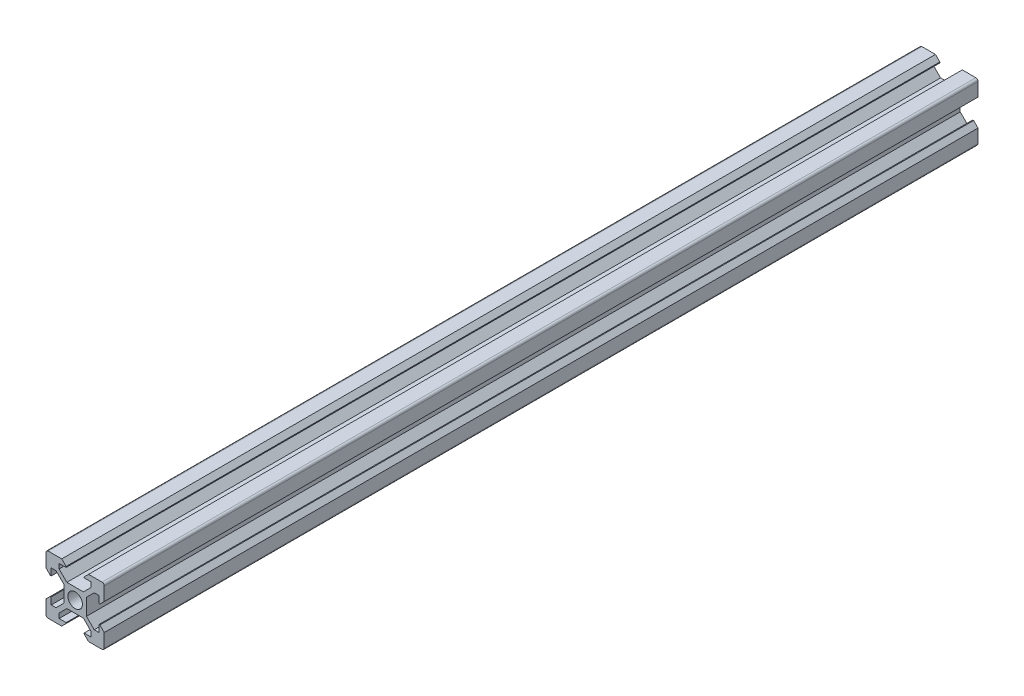
from build123d import *

# Parameters (mm, degrees)
CROQUIS1_R              = 2.5
SALIENTE_EXTRUIR1_DEPTH = 300


with BuildPart() as part:
    # Croquis1 → Saliente-Extruir1 (new body)
    with BuildSketch(Plane.XY):
        with BuildLine():
            Line((-4.6, 10), (-3.1, 8.5))
            Line((-3.1, 8.5), (-3.1, 8.2))
            Line((-3.1, 8.2), (-5.5, 8.2))
            Line((-5.5, 8.2), (-5.5, 6.560660172))
            Line((-5.5, 6.560660172), (-2.84, 3.900660172))
            Line((-2.84, 3.900660172), (0, 3.900660172))
            Line((0, 3.900660172), (2.84, 3.900660172))
            Line((2.84, 3.900660172), (5.5, 6.560660172))
            Line((5.5, 6.560660172), (5.5, 8.2))
            Line((5.5, 8.2), (3.1, 8.2))
            Line((3.1, 8.2), (3.1, 8.5))
            Line((3.1, 8.5), (4.6, 10))
            Line((4.6, 10), (9.25, 10))
            ThreePointArc((9.25, 10), (9.780330086, 9.780330086), (10, 9.25))
            Line((10, 9.25), (10, 4.6))
            Line((10, 4.6), (8.5, 3.1))
            Line((8.5, 3.1), (8.2, 3.1))
            Line((8.2, 3.1), (8.2, 5.5))
            Line((8.2, 5.5), (6.560660172, 5.5))
            Line((6.560660172, 5.5), (3.900660172, 2.84))
            Line((3.900660172, 2.84), (3.900660172, 0))
            Line((3.900660172, 0), (3.900660172, -2.84))
            Line((3.900660172, -2.84), (6.560660172, -5.5))
            Line((6.560660172, -5.5), (8.2, -5.5))
            Line((8.2, -5.5), (8.2, -3.1))
            Line((8.2, -3.1), (8.5, -3.1))
            Line((8.5, -3.1), (10, -4.6))
            Line((10, -4.6), (10, -9.25))
            ThreePointArc((10, -9.25), (9.780330086, -9.780330086), (9.25, -10))
            Line((9.25, -10), (4.6, -10))
            Line((4.6, -10), (3.1, -8.5))
            Line((3.1, -8.5), (3.1, -8.2))
            Line((3.1, -8.2), (5.5, -8.2))
            Line((5.5, -8.2), (5.5, -6.560660172))
            Line((5.5, -6.560660172), (2.84, -3.900660172))
            Line((2.84, -3.900660172), (0, -3.900660172))
            Line((0, -3.900660172), (-2.84, -3.900660172))
            Line((-2.84, -3.900660172), (-5.5, -6.560660172))
            Line((-5.5, -6.560660172), (-5.5, -8.2))
            Line((-5.5, -8.2), (-3.1, -8.2))
            Line((-3.1, -8.2), (-3.1, -8.5))
            Line((-3.1, -8.5), (-4.6, -10))
            Line((-4.6, -10), (-9.25, -10))
            ThreePointArc((-9.25, -10), (-9.780330086, -9.780330086), (-10, -9.25))
            Line((-10, -9.25), (-10, -4.6))
            Line((-10, -4.6), (-8.5, -3.1))
            Line((-8.5, -3.1), (-8.2, -3.1))
            Line((-8.2, -3.1), (-8.2, -5.5))
            Line((-8.2, -5.5), (-6.560660172, -5.5))
            Line((-6.560660172, -5.5), (-3.900660172, -2.84))
            Line((-3.900660172, -2.84), (-3.900660172, 0))
            Line((-3.900660172, 0), (-3.900660172, 2.84))
            Line((-3.900660172, 2.84), (-6.560660172, 5.5))
            Line((-6.560660172, 5.5), (-8.2, 5.5))
            Line((-8.2, 5.5), (-8.2, 3.1))
            Line((-8.2, 3.1), (-8.5, 3.1))
            Line((-8.5, 3.1), (-10, 4.6))
            Line((-10, 4.6), (-10, 9.25))
            ThreePointArc((-10, 9.25), (-9.780330086, 9.780330086), (-9.25, 10))
            Line((-9.25, 10), (-4.6, 10))
        make_face()
        Circle(CROQUIS1_R, mode=Mode.SUBTRACT)
    extrude(amount=SALIENTE_EXTRUIR1_DEPTH)


solid = part.part
